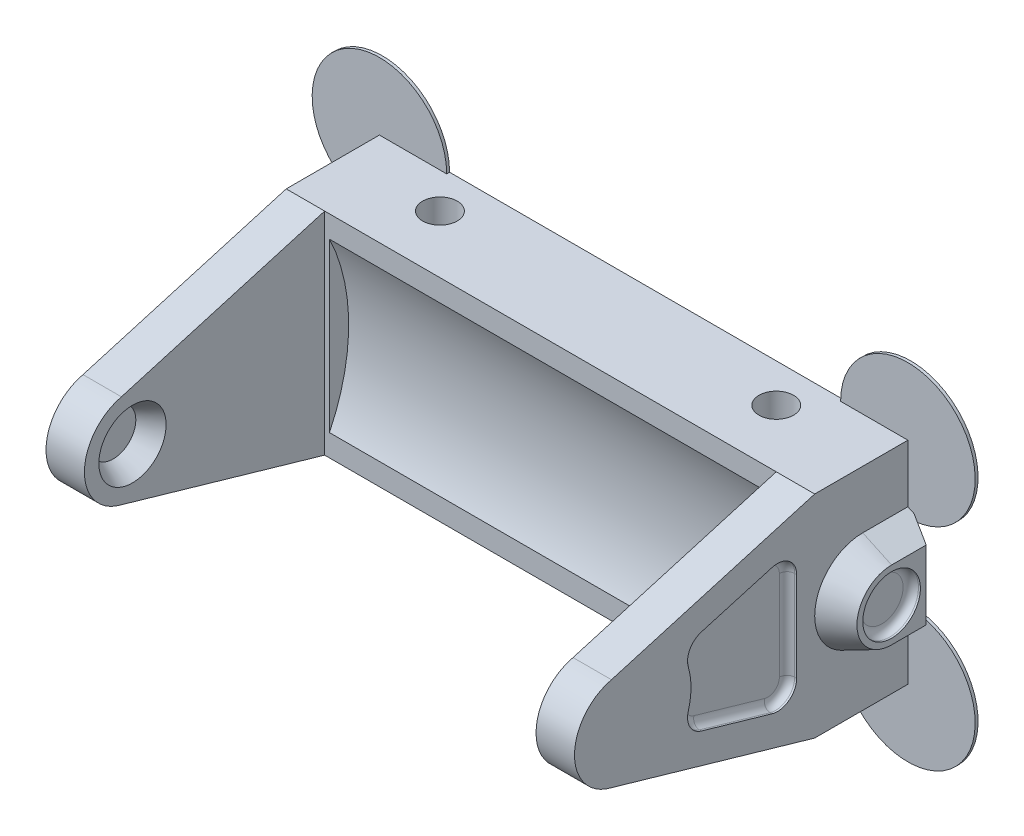
from build123d import *

# Parameters (mm, degrees)
SKETCH1_W               = 55
SKETCH1_H               = 22
BOSS_EXTRUDE1_DEPTH     = 10
CUT_EXTRUDE1_DEPTH      = 32.260998065
CUT_EXTRUDE1_DEPTH_BACK = 32.260998065
SKETCH2_R               = 1.8
BOSS_EXTRUDE2_START     = -27.5
BOSS_EXTRUDE2_DEPTH     = 4
BOSS_EXTRUDE3_START     = 23.5
BOSS_EXTRUDE3_DEPTH     = 4
CUT_EXTRUDE2_START      = -23.5
SKETCH4_R               = 3.5
CUT_EXTRUDE2_DEPTH      = 2
CUT_EXTRUDE2_DRAFT      = -30
CUT_EXTRUDE3_START      = 23.5
SKETCH4_2_R             = 3.5
CUT_EXTRUDE3_DEPTH      = 2
CUT_EXTRUDE3_TAPER      = 30
CUT_EXTRUDE4_DEPTH      = 23
BOSS_EXTRUDE4_START     = 27.5
BOSS_EXTRUDE4_DEPTH     = 3
BOSS_EXTRUDE4_TAPER     = 25
BOSS_EXTRUDE5_START     = -27.5
BOSS_EXTRUDE5_DEPTH     = 3
BOSS_EXTRUDE5_DRAFT     = -25
CUT_EXTRUDE5_START      = 30.5
SKETCH7_R               = 3
CUT_EXTRUDE5_DEPTH      = 1
CUT_EXTRUDE6_START      = -29.5
SKETCH7_2_R             = 3
CUT_EXTRUDE6_DEPTH      = 1
CUT_EXTRUDE7_START      = 27.5
CUT_EXTRUDE7_DEPTH      = 1
CUT_EXTRUDE8_START      = -26.5
CUT_EXTRUDE8_DEPTH      = 1
SKETCH9_R               = 7.00121046
BOSS_EXTRUDE6_DEPTH     = 0.3
FILLET1_R               = 0.8


with BuildPart() as part:
    # Sketch1 → Boss-Extrude1 (new body)
    with BuildSketch(Plane.XY):
        Rectangle(SKETCH1_W, SKETCH1_H)
    extrude(amount=BOSS_EXTRUDE1_DEPTH)

    # Sketch2 → Cut-Extrude1 (cut, two sides: drawn at the far end of the back side and taken through both)
    with BuildSketch(Plane(origin=(0, 0, 0), x_dir=(1, 0, 0), z_dir=(0, 1, 0)).offset(-CUT_EXTRUDE1_DEPTH_BACK)):
        with Locations(Location((-17.5, -4, 0), (0, 0, 270))):
            Circle(SKETCH2_R)
        with Locations(Location((17.5, -4, 0), (0, 0, 270))):
            Circle(SKETCH2_R)
    extrude(amount=CUT_EXTRUDE1_DEPTH + CUT_EXTRUDE1_DEPTH_BACK, mode=Mode.SUBTRACT)

    # Sketch3 → Boss-Extrude2 (add)
    with BuildSketch(Plane(origin=(0, 0, 0), x_dir=(0, 0, -1), z_dir=(1, 0, 0)).offset(BOSS_EXTRUDE2_START)):
        with BuildLine():
            Line((-31.151137667, 4.83507467), (-10, 11))
            Line((-10, 11), (-10, -11))
            Line((-10, -11), (-31.167743327, -4.892335032))
            ThreePointArc((-31.167743327, -4.892335032), (-34.999992715, -0.022073975), (-31.151137667, 4.83507467))
        make_face()
    extrude(amount=BOSS_EXTRUDE2_DEPTH)

    # Sketch3<2> → Boss-Extrude3 (add)
    with BuildSketch(Plane(origin=(0, 0, 0), x_dir=(0, 0, -1), z_dir=(1, 0, 0)).offset(BOSS_EXTRUDE3_START)):
        with BuildLine():
            Line((-31.151137667, 4.83507467), (-10, 11))
            Line((-10, 11), (-10, -11))
            Line((-10, -11), (-31.167743327, -4.892335032))
            ThreePointArc((-31.167743327, -4.892335032), (-34.999992715, -0.022073975), (-31.151137667, 4.83507467))
        make_face()
    extrude(amount=BOSS_EXTRUDE3_DEPTH)


with BuildPart() as cut_extrude2_tool:
    # Sketch4 → Cut-Extrude2 (with draft: the straight prism first)
    with BuildSketch(Plane(origin=(0, 0, 0), x_dir=(0, 0, -1), z_dir=(1, 0, 0)).offset(CUT_EXTRUDE2_START)):
        with Locations((-30, 0)):
            Circle(SKETCH4_R)
    extrude(amount=-CUT_EXTRUDE2_DEPTH)
    # Cut-Extrude2: the draft: its side faces are tilted about the plane it starts from
    cut_extrude2_sides = [cut_extrude2_tool.faces().sort_by_distance(p)[0] for p in [
        (-24.5, 0, 33.5),
    ]]
    draft(cut_extrude2_sides, Plane(origin=(0, 0, 0), x_dir=(0, 0, -1), z_dir=(1, 0, 0)).offset(CUT_EXTRUDE2_START), CUT_EXTRUDE2_DRAFT)


with BuildPart() as part_1:
    add(part.part)

    # Cut-Extrude2: cut by cut_extrude2_tool
    add(cut_extrude2_tool.part, mode=Mode.SUBTRACT)

    # Sketch4<2> → Cut-Extrude3 (cut)
    with BuildSketch(Plane(origin=(0, 0, 0), x_dir=(0, 0, -1), z_dir=(1, 0, 0)).offset(CUT_EXTRUDE3_START)):
        with Locations((-30, 0)):
            Circle(SKETCH4_2_R)
    extrude(amount=CUT_EXTRUDE3_DEPTH, taper=CUT_EXTRUDE3_TAPER, mode=Mode.SUBTRACT)

    # Sketch5 → Cut-Extrude4 (cut, symmetric)
    with BuildSketch(Plane(origin=(0, 0, 0), x_dir=(0, 0, -1), z_dir=(1, 0, 0))):
        with BuildLine():
            Line((-20.614301305, 18.586324402), (-20.058086713, -18.355544485))
            ThreePointArc((-20.058086713, -18.355544485), (-8.002266591, 0.301095517), (-20.614301305, 18.586324402))
        make_face()
    extrude(amount=CUT_EXTRUDE4_DEPTH, both=True, mode=Mode.SUBTRACT)

    # Sketch6 → Boss-Extrude4 (add)
    with BuildSketch(Plane(origin=(0, 0, 0), x_dir=(0, 0, -1), z_dir=(1, 0, 0)).offset(BOSS_EXTRUDE4_START)):
        with BuildLine():
            Line((0, -5), (0, 5))
            Line((0, 5), (-5, 5))
            ThreePointArc((-5, 5), (-10, 0), (-5, -5))
            Line((-5, -5), (0, -5))
        make_face()
    extrude(amount=BOSS_EXTRUDE4_DEPTH, taper=BOSS_EXTRUDE4_TAPER)


with BuildPart() as boss_extrude5_tool:
    # Sketch6<2> → Boss-Extrude5 (with draft: the straight prism first)
    with BuildSketch(Plane(origin=(0, 0, 0), x_dir=(0, 0, -1), z_dir=(1, 0, 0)).offset(BOSS_EXTRUDE5_START)):
        with BuildLine():
            Line((0, -5), (0, 5))
            Line((0, 5), (-5, 5))
            ThreePointArc((-5, 5), (-10, 0), (-5, -5))
            Line((-5, -5), (0, -5))
        make_face()
    extrude(amount=-BOSS_EXTRUDE5_DEPTH)
    # Boss-Extrude5: the draft: its side faces are tilted about the plane it starts from
    boss_extrude5_sides = [boss_extrude5_tool.faces().sort_by_distance(p)[0] for p in [
        (-29, -5, 2.5),
        (-29, 0, 0),
        (-29, 5, 2.5),
        (-29, 0, 10),
    ]]
    draft(boss_extrude5_sides, Plane(origin=(0, 0, 0), x_dir=(0, 0, -1), z_dir=(1, 0, 0)).offset(BOSS_EXTRUDE5_START), BOSS_EXTRUDE5_DRAFT)


with BuildPart() as part_2:
    add(part_1.part)

    # Boss-Extrude5: add boss_extrude5_tool
    add(boss_extrude5_tool.part)

    # Sketch7 → Cut-Extrude5 (cut)
    with BuildSketch(Plane(origin=(0, 0, 0), x_dir=(0, 0, -1), z_dir=(1, 0, 0)).offset(CUT_EXTRUDE5_START)):
        with Locations(Location((-5, 0, 0), (0, 0, 270))):
            Circle(SKETCH7_R)
    extrude(amount=-CUT_EXTRUDE5_DEPTH, mode=Mode.SUBTRACT)

    # Sketch7<2> → Cut-Extrude6 (cut)
    with BuildSketch(Plane(origin=(0, 0, 0), x_dir=(0, 0, -1), z_dir=(1, 0, 0)).offset(CUT_EXTRUDE6_START)):
        with Locations(Location((-5, 0, 0), (0, 0, 270))):
            Circle(SKETCH7_2_R)
    extrude(amount=-CUT_EXTRUDE6_DEPTH, mode=Mode.SUBTRACT)

    # Sketch8 → Cut-Extrude7 (cut)
    with BuildSketch(Plane(origin=(0, 0, 0), x_dir=(0, 0, -1), z_dir=(1, 0, 0)).offset(CUT_EXTRUDE7_START)):
        with BuildLine():
            Line((-11.878371675, 4.672816565), (-11.878371675, -4.672816565))
            ThreePointArc((-11.878371675, -4.672816565), (-12.676601149, -6.271487138), (-14.434119277, -6.594051741))
            Line((-14.434119277, -6.594051741), (-21.789358175, -4.466432788))
            ThreePointArc((-21.789358175, -4.466432788), (-22.985578278, -3.509878473), (-23.154296174, -1.987553618))
            ThreePointArc((-23.154296174, -1.987553618), (-22.871603949, 0), (-23.154296174, 1.987553618))
            ThreePointArc((-23.154296174, 1.987553618), (-22.985578278, 3.509878473), (-21.789358175, 4.466432788))
            Line((-21.789358175, 4.466432788), (-14.434119277, 6.594051741))
            ThreePointArc((-14.434119277, 6.594051741), (-12.676601149, 6.271487138), (-11.878371675, 4.672816565))
        make_face()
    extrude(amount=-CUT_EXTRUDE7_DEPTH, mode=Mode.SUBTRACT)

    # Sketch8<2> → Cut-Extrude8 (cut)
    with BuildSketch(Plane(origin=(0, 0, 0), x_dir=(0, 0, -1), z_dir=(1, 0, 0)).offset(CUT_EXTRUDE8_START)):
        with BuildLine():
            Line((-11.878371675, 4.672816565), (-11.878371675, -4.672816565))
            ThreePointArc((-11.878371675, -4.672816565), (-12.676601149, -6.271487138), (-14.434119277, -6.594051741))
            Line((-14.434119277, -6.594051741), (-21.789358175, -4.466432788))
            ThreePointArc((-21.789358175, -4.466432788), (-22.985578278, -3.509878473), (-23.154296174, -1.987553618))
            ThreePointArc((-23.154296174, -1.987553618), (-22.871603949, 0), (-23.154296174, 1.987553618))
            ThreePointArc((-23.154296174, 1.987553618), (-22.985578278, 3.509878473), (-21.789358175, 4.466432788))
            Line((-21.789358175, 4.466432788), (-14.434119277, 6.594051741))
            ThreePointArc((-14.434119277, 6.594051741), (-12.676601149, 6.271487138), (-11.878371675, 4.672816565))
        make_face()
    extrude(amount=-CUT_EXTRUDE8_DEPTH, mode=Mode.SUBTRACT)

    # Sketch9 → Boss-Extrude6 (add)
    with BuildSketch(Plane.XY):
        with Locations((27.5, 11)):
            Circle(SKETCH9_R)
        with Locations((-27.5, 11)):
            Circle(SKETCH9_R)
        with Locations((-27.5, -11)):
            Circle(SKETCH9_R)
        with Locations((27.5, -11)):
            Circle(SKETCH9_R)
    extrude(amount=BOSS_EXTRUDE6_DEPTH)

    # Fillet1
    fillet1_edges = [part_2.edges().sort_by_distance(p)[0] for p in [
        (26.5, 0, 22.871603949),
        (26.5, 5.530242265, 18.111738726),
        (26.5, 0, 11.878371675),
        (26.5, -5.530242265, 18.111738726),
        (26.5, -3.509878473, 22.985578278),
        (26.5, 3.509878473, 22.985578278),
        (26.5, 6.271487138, 12.676601149),
        (26.5, -6.271487138, 12.676601149),
        (-26.5, 0, 22.871603949),
        (-26.5, -3.509878473, 22.985578278),
        (-26.5, -5.530242265, 18.111738726),
        (-26.5, -6.271487138, 12.676601149),
        (-26.5, 0, 11.878371675),
        (-26.5, 6.271487138, 12.676601149),
        (-26.5, 5.530242265, 18.111738726),
        (-26.5, 3.509878473, 22.985578278),
        (29.5, 3, 5),
        (-29.5, 3, 5),
    ]]
    fillet(fillet1_edges, radius=FILLET1_R)


solid = part_2.part
